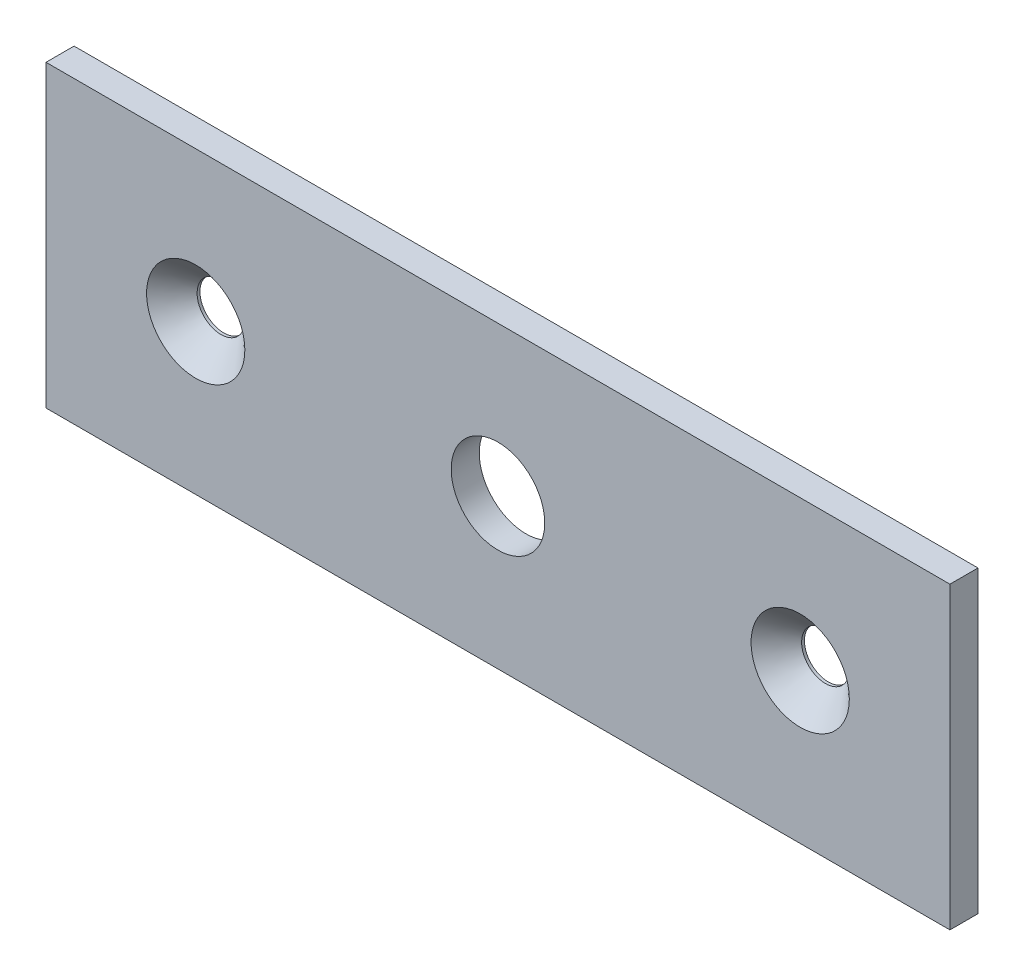
from build123d import *

# Parameters (mm, degrees)
SKETCH1_W                                  = 96.6
SKETCH1_H                                  = 32
BOSS_EXTRUDE1_DEPTH                        = 3
SKETCH2_R                                  = 5
CUT_EXTRUDE1_DEPTH                         = 79.565348097
FRAISAGE_POUR_VIS_T_TE_FRAIS_E_BOM_2_COUNT = 2
FRAISAGE_POUR_VIS_T_TE_FRAIS_E_BOM_2_PITCH = 64.6


with BuildPart() as part:
    # Sketch1 → Boss-Extrude1 (new body)
    with BuildSketch(Plane.XY):
        with Locations((28.417538555, 0.671328671)):
            Rectangle(SKETCH1_W, SKETCH1_H)
    extrude(amount=BOSS_EXTRUDE1_DEPTH)

    # Sketch2 → Cut-Extrude1 (cut, through all)
    with BuildSketch(Plane.XY.offset(3)):
        with Locations((28.417538555, 0.671328671)):
            Circle(SKETCH2_R)
    extrude(amount=-CUT_EXTRUDE1_DEPTH, mode=Mode.SUBTRACT)

    # Esquisse3 → Fraisage pour vis à tête fraisée bombée #51 (revolve, cut)
    with BuildSketch(Plane(origin=(-3.882461445, 0.671328671, 3), x_dir=(0, -1, 0), z_dir=(1, 0, 0))):
        Polygon((0, 0), (0, 3), (2.54999998, 3), (2.54999998, 2.700000061), (5.250000041, 0), align=None)
    fraisage_pour_vis_t_te_frais_e_bomb_e = revolve(axis=Axis((-3.882461445, 0.671328671, 9.35), (0, 0, -1)), mode=Mode.SUBTRACT)

    # Fraisage pour vis _ t_te frais_e bom 2: Fraisage pour vis à tête fraisée bombée #51 ×2
    with Locations(*[(i * FRAISAGE_POUR_VIS_T_TE_FRAIS_E_BOM_2_PITCH, 0, 0) for i in range(1, FRAISAGE_POUR_VIS_T_TE_FRAIS_E_BOM_2_COUNT)]):
        add(fraisage_pour_vis_t_te_frais_e_bomb_e, mode=Mode.SUBTRACT)


solid = part.part
